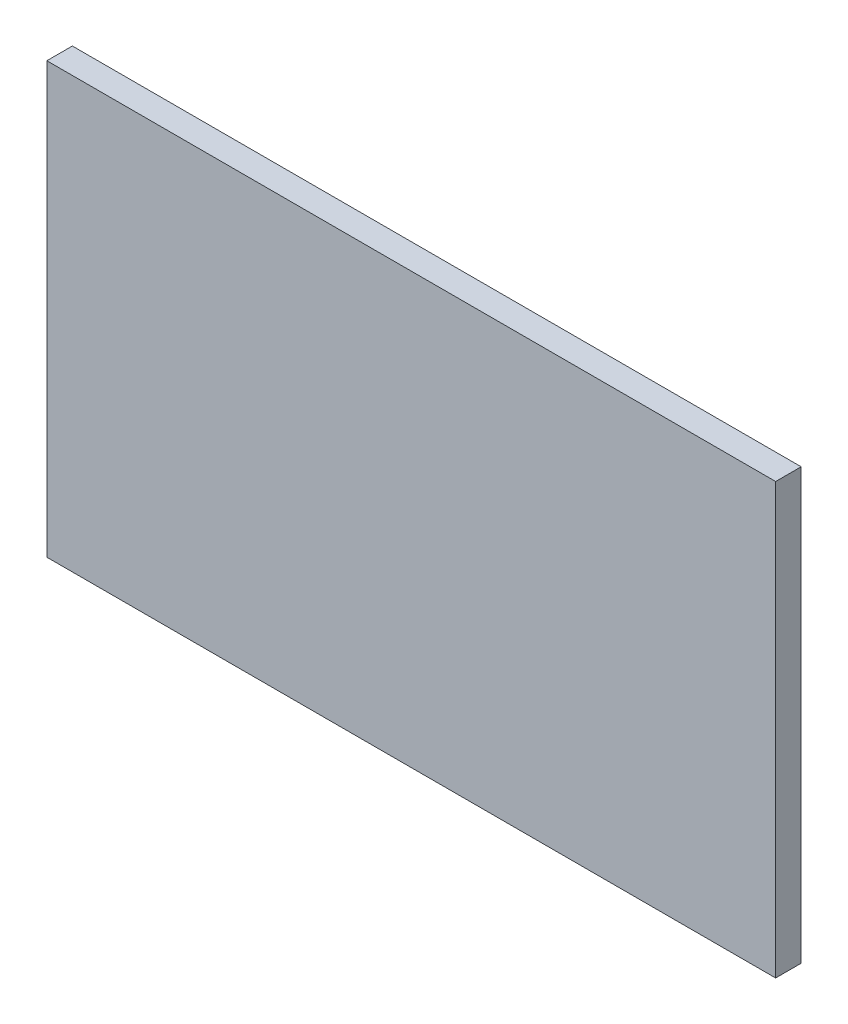
from build123d import *

# Parameters (mm, degrees)
SKETCH1_W           = 508
SKETCH1_H           = 299.72
BOSS_EXTRUDE1_DEPTH = 17.78


with BuildPart() as part:
    # Sketch1 → Boss-Extrude1 (new body)
    with BuildSketch(Plane.XY):
        Rectangle(SKETCH1_W, SKETCH1_H)
    extrude(amount=BOSS_EXTRUDE1_DEPTH)


solid = part.part
